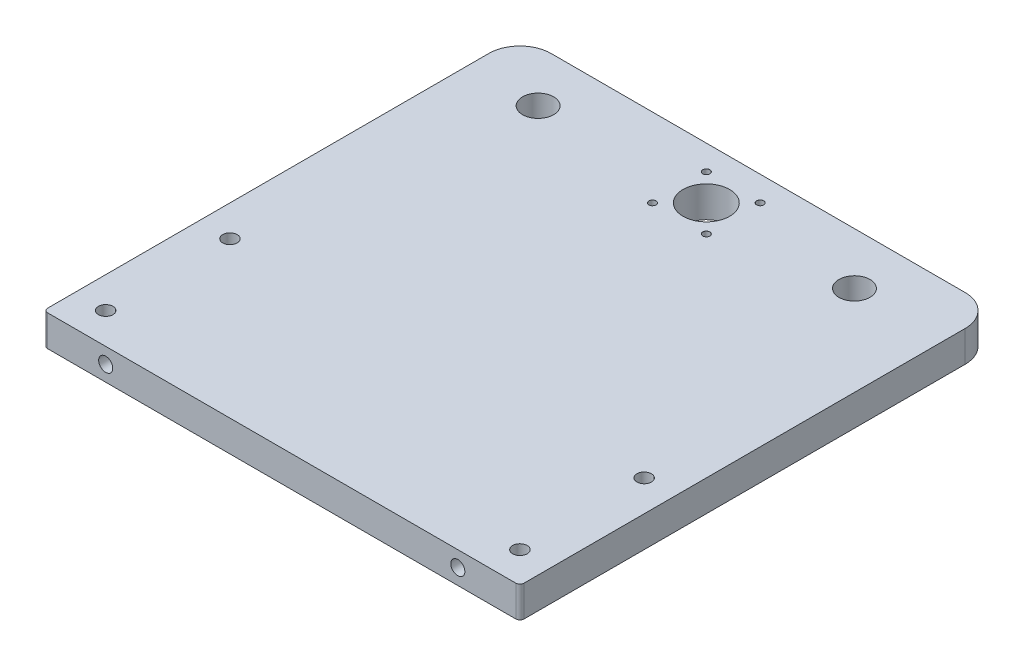
from build123d import *

# Parameters (mm, degrees)
SKIZZE1_W                                 = 230
SKIZZE1_H                                 = 230
AUFSATZ_LINEAR_AUSTRAGEN1_DEPTH           = 15
F_15_0_15_DURCHMESSER_BOHRUNG1_D          = 15
F_3_4_3_4_DURCHMESSER_BOHRUNG1_AT_2_COUNT = 2
F_3_4_3_4_DURCHMESSER_BOHRUNG1_AT_2_PITCH = 26
F_3_4_3_4_DURCHMESSER_BOHRUNG1_AT_3_COUNT = 2
F_3_4_3_4_DURCHMESSER_BOHRUNG1_AT_3_PITCH = 26
F_3_4_3_4_DURCHMESSER_BOHRUNG1_AT_4_COUNT = 2
F_3_4_3_4_DURCHMESSER_BOHRUNG1_AT_4_PITCH = 36.769552622
F_22_5_22_5_DURCHMESSER_BOHRUNG1_D        = 22.5
F_7_0_7_DURCHMESSER_BOHRUNG1_D            = 7
VERRUNDUNG5_R                             = 15
VERRUNDUNG6_R                             = 2
M8_GEWINDEBOHRUNG1_D                      = 6.8
M8_GEWINDEBOHRUNG1_DEPTH                  = 30
M8_GEWINDEBOHRUNG1_TIP                    = 2.042926105


with BuildPart() as part:
    # Skizze1 → Aufsatz-Linear austragen1 (new body)
    with BuildSketch(Plane(origin=(0, 0, 0), x_dir=(1, 0, 0), z_dir=(0, 1, 0))):
        Rectangle(SKIZZE1_W, SKIZZE1_H)
    extrude(amount=AUFSATZ_LINEAR_AUSTRAGEN1_DEPTH)

    # Ø15.0 (15) Durchmesser Bohrung1 (through all)
    with Locations(Plane(origin=(0, 15, 0), x_dir=(1, 0, 0), z_dir=(0, 1, 0))):
        with Locations((-81.223039609, 90), (71.525536654, 90)):
            Hole(F_15_0_15_DURCHMESSER_BOHRUNG1_D / 2)

    # Skizze9 → Ø3.4 (3.4) Durchmesser Bohrung1 (revolve, cut)
    with BuildSketch(Plane(origin=(-13, 15, -103), x_dir=(0, 0, 1), z_dir=(1, 0, 0))):
        Polygon((0, 0), (0, 15), (1.725, 15), (1.7, 14.975), (1.7, 0.025), (1.725, 0), align=None)
    f_3_4_3_4_durchmesser_bohrung1 = revolve(axis=Axis((-13, 21.35, -103), (0, -1, 0)), mode=Mode.SUBTRACT)

    # Ø3.4 (3.4) Durchmesser Bohrung1 at 2: Ø3.4 (3.4) Durchmesser Bohrung1 ×2
    with Locations(*[(i * F_3_4_3_4_DURCHMESSER_BOHRUNG1_AT_2_PITCH, 0, 0) for i in range(1, F_3_4_3_4_DURCHMESSER_BOHRUNG1_AT_2_COUNT)]):
        add(f_3_4_3_4_durchmesser_bohrung1, mode=Mode.SUBTRACT)

    # Ø3.4 (3.4) Durchmesser Bohrung1 at 3: Ø3.4 (3.4) Durchmesser Bohrung1 ×2
    with Locations(*[(0, 0, i * F_3_4_3_4_DURCHMESSER_BOHRUNG1_AT_3_PITCH) for i in range(1, F_3_4_3_4_DURCHMESSER_BOHRUNG1_AT_3_COUNT)]):
        add(f_3_4_3_4_durchmesser_bohrung1, mode=Mode.SUBTRACT)

    # Ø3.4 (3.4) Durchmesser Bohrung1 at 4: Ø3.4 (3.4) Durchmesser Bohrung1 ×2
    with Locations(*[Vector(0.7071067811865476, 0, 0.7071067811865475) * (i * F_3_4_3_4_DURCHMESSER_BOHRUNG1_AT_4_PITCH) for i in range(1, F_3_4_3_4_DURCHMESSER_BOHRUNG1_AT_4_COUNT)]):
        add(f_3_4_3_4_durchmesser_bohrung1, mode=Mode.SUBTRACT)

    # Ø22.5 (22.5) Durchmesser Bohrung1 (through all)
    with Locations(Plane(origin=(0, 15, 0), x_dir=(1, 0, 0), z_dir=(0, 1, 0))):
        with Locations((0, 90)):
            Hole(F_22_5_22_5_DURCHMESSER_BOHRUNG1_D / 2)

    # Ø7.0 (7) Durchmesser Bohrung1 (through all)
    with Locations(Plane(origin=(0, 15, 0), x_dir=(1, 0, 0), z_dir=(0, 1, 0))):
        with Locations((-100, -40), (-100, -100), (100, -40), (100, -100)):
            Hole(F_7_0_7_DURCHMESSER_BOHRUNG1_D / 2)

    # Verrundung5
    verrundung5_edges = [part.edges().sort_by_distance(p)[0] for p in [
        (-115, 7.5, -115),
        (115, 7.5, -115),
    ]]
    fillet(verrundung5_edges, radius=VERRUNDUNG5_R)

    # Verrundung6
    verrundung6_edges = [part.edges().sort_by_distance(p)[0] for p in [
        (115, 7.5, 115),
        (-115, 7.5, 115),
    ]]
    fillet(verrundung6_edges, radius=VERRUNDUNG6_R)

    # M8 Gewindebohrung1
    with Locations(Plane.XY.offset(115)):
        with Locations((-85, 7.5), (85, 7.5)):
            Hole(M8_GEWINDEBOHRUNG1_D / 2, depth=M8_GEWINDEBOHRUNG1_DEPTH)
            with Locations((0, 0, -(M8_GEWINDEBOHRUNG1_DEPTH + M8_GEWINDEBOHRUNG1_TIP / 2))):  # 118° drill point
                Cone(0, M8_GEWINDEBOHRUNG1_D / 2, M8_GEWINDEBOHRUNG1_TIP, mode=Mode.SUBTRACT)


solid = part.part
